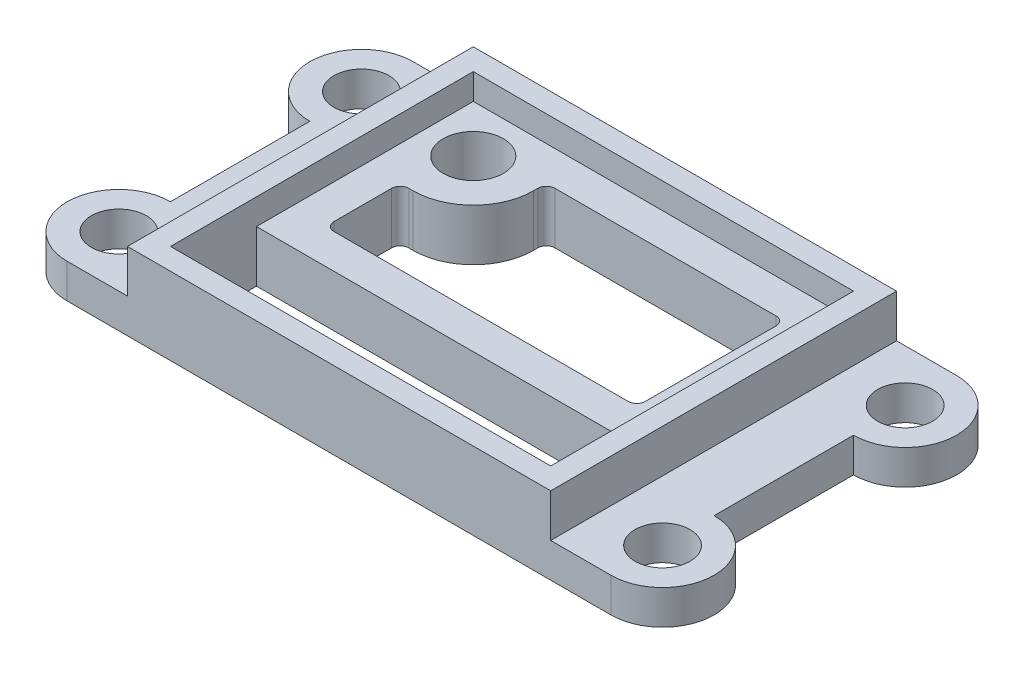
from build123d import *

# Parameters (mm, degrees)
SKETCH1_W           = 24.6
SKETCH1_H           = 20.1
SKETCH1_R           = 1.75
BOSS_EXTRUDE1_DEPTH = 1.5
SKETCH2_W           = 24.6
SKETCH2_H           = 20.1
SKETCH2_W_2         = 22.1
SKETCH2_H_2         = 17.6
BOSS_EXTRUDE2_DEPTH = 3
SKETCH3_W           = 22.1
SKETCH3_H           = 12.6
SKETCH3_R           = 1.75
BOSS_EXTRUDE3_DEPTH = 1.5
SKETCH4_R           = 1.6
BOSS_EXTRUDE4_DEPTH = 2
CUT_EXTRUDE1_DEPTH  = 22.527714695
SKETCH6_W           = 22.1
SKETCH6_H           = 5
CUT_EXTRUDE2_DEPTH  = 22.527714695
SKETCH8_W           = 3.5
SKETCH8_H           = 8.1
BOSS_EXTRUDE5_DEPTH = 2


with BuildPart() as part:
    # Sketch1 → Boss-Extrude1 (new body)
    with BuildSketch(Plane(origin=(0, 0, 0), x_dir=(1, 0, 0), z_dir=(0, 1, 0))):
        Rectangle(SKETCH1_W, SKETCH1_H)
        with Locations(Location((-8.3, 6.05, 0), (0, 0, 270))):
            Circle(SKETCH1_R, mode=Mode.SUBTRACT)
    extrude(amount=BOSS_EXTRUDE1_DEPTH)

    # Sketch2 → Boss-Extrude2 (add)
    with BuildSketch(Plane(origin=(0, 1.5, 0), x_dir=(1, 0, 0), z_dir=(0, 1, 0))):
        Rectangle(SKETCH2_W, SKETCH2_H)
        Rectangle(SKETCH2_W_2, SKETCH2_H_2, mode=Mode.SUBTRACT)
    extrude(amount=BOSS_EXTRUDE2_DEPTH)

    # Sketch3 → Boss-Extrude3 (add)
    with BuildSketch(Plane(origin=(0, 1.5, 0), x_dir=(1, 0, 0), z_dir=(0, 1, 0))):
        with Locations((0, 2.5)):
            Rectangle(SKETCH3_W, SKETCH3_H)
        with Locations(Location((-8.3, 6.05, 0), (0, 0, 270))):
            Circle(SKETCH3_R, mode=Mode.SUBTRACT)
    extrude(amount=BOSS_EXTRUDE3_DEPTH)

    # Sketch4 → Boss-Extrude4 (add)
    # profile 1 of 4: a face of its own
    with BuildSketch(Plane(origin=(0, 0, 0), x_dir=(1, 0, 0), z_dir=(0, 1, 0))):
        with BuildLine():
            Line((15.8, 10.05), (12.3, 10.05))
            Line((12.3, 10.05), (12.3, 4.05))
            Line((12.3, 4.05), (15.8, 4.05))
            ThreePointArc((15.8, 4.05), (18.8, 7.05), (15.8, 10.05))
        make_face()
        with Locations(Location((15.8, 7.05, 0), (0, 0, 270))):
            Circle(SKETCH4_R, mode=Mode.SUBTRACT)
    # profile 2 of 4: a face of its own
    with BuildSketch(Plane(origin=(0, 0, 0), x_dir=(1, 0, 0), z_dir=(0, 1, 0))):
        with BuildLine():
            Line((-15.8, 4.05), (-12.3, 4.05))
            Line((-12.3, 4.05), (-12.3, 10.05))
            Line((-12.3, 10.05), (-15.8, 10.05))
            ThreePointArc((-15.8, 10.05), (-18.8, 7.05), (-15.8, 4.05))
        make_face()
        with Locations(Location((-15.8, 7.05, 0), (0, 0, 90))):
            Circle(SKETCH4_R, mode=Mode.SUBTRACT)
    # profile 3 of 4: a face of its own
    with BuildSketch(Plane(origin=(0, 0, 0), x_dir=(1, 0, 0), z_dir=(0, 1, 0))):
        with BuildLine():
            Line((15.8, -4.05), (12.3, -4.05))
            Line((12.3, -4.05), (12.3, -10.05))
            Line((12.3, -10.05), (15.8, -10.05))
            ThreePointArc((15.8, -10.05), (18.8, -7.05), (15.8, -4.05))
        make_face()
        with Locations(Location((15.8, -7.05, 0), (0, 0, 90))):
            Circle(SKETCH4_R, mode=Mode.SUBTRACT)
    # profile 4 of 4: a face of its own
    with BuildSketch(Plane(origin=(0, 0, 0), x_dir=(1, 0, 0), z_dir=(0, 1, 0))):
        with BuildLine():
            Line((-15.8, -10.05), (-12.3, -10.05))
            Line((-12.3, -10.05), (-12.3, -4.05))
            Line((-12.3, -4.05), (-15.8, -4.05))
            ThreePointArc((-15.8, -4.05), (-18.8, -7.05), (-15.8, -10.05))
        make_face()
        with Locations(Location((-15.8, -7.05, 0), (0, 0, 270))):
            Circle(SKETCH4_R, mode=Mode.SUBTRACT)
    extrude(amount=BOSS_EXTRUDE4_DEPTH)

    # Sketch5 → Cut-Extrude1 (cut, through all)
    with BuildSketch(Plane(origin=(0, 3, 0), x_dir=(1, 0, 0), z_dir=(0, 1, 0))):
        with BuildLine():
            Line((-9.05, -1.3), (-9.05, 2.05))
            ThreePointArc((-9.05, 2.05), (-8.903553391, 2.403553391), (-8.55, 2.55))
            Line((-8.55, 2.55), (-8.3, 2.55))
            ThreePointArc((-8.3, 2.55), (-5.825126266, 3.575126266), (-4.8, 6.05))
            Line((-4.8, 6.05), (-4.8, 6.3))
            ThreePointArc((-4.8, 6.3), (-4.653553391, 6.653553391), (-4.3, 6.8))
            Line((-4.3, 6.8), (8.55, 6.8))
            ThreePointArc((8.55, 6.8), (8.903553391, 6.653553391), (9.05, 6.3))
            Line((9.05, 6.3), (9.05, -1.3))
            ThreePointArc((9.05, -1.3), (8.903553391, -1.653553391), (8.55, -1.8))
            Line((8.55, -1.8), (-8.55, -1.8))
            ThreePointArc((-8.55, -1.8), (-8.903553391, -1.653553391), (-9.05, -1.3))
        make_face()
    extrude(amount=-CUT_EXTRUDE1_DEPTH, mode=Mode.SUBTRACT)

    # Sketch6 → Cut-Extrude2 (cut, through all)
    with BuildSketch(Plane(origin=(0, 1.5, 0), x_dir=(1, 0, 0), z_dir=(0, 1, 0))):
        with Locations((0, -6.3)):
            Rectangle(SKETCH6_W, SKETCH6_H)
    extrude(amount=-CUT_EXTRUDE2_DEPTH, mode=Mode.SUBTRACT)

    # Sketch8 → Boss-Extrude5 (add, through all)
    with BuildSketch(Plane(origin=(0, 2, 0), x_dir=(1, 0, 0), z_dir=(0, 1, 0))):
        with Locations((-14.05, 0)):
            Rectangle(SKETCH8_W, SKETCH8_H)
        with Locations((14.05, 0)):
            Rectangle(SKETCH8_W, SKETCH8_H)
    extrude(amount=-BOSS_EXTRUDE5_DEPTH)


solid = part.part
